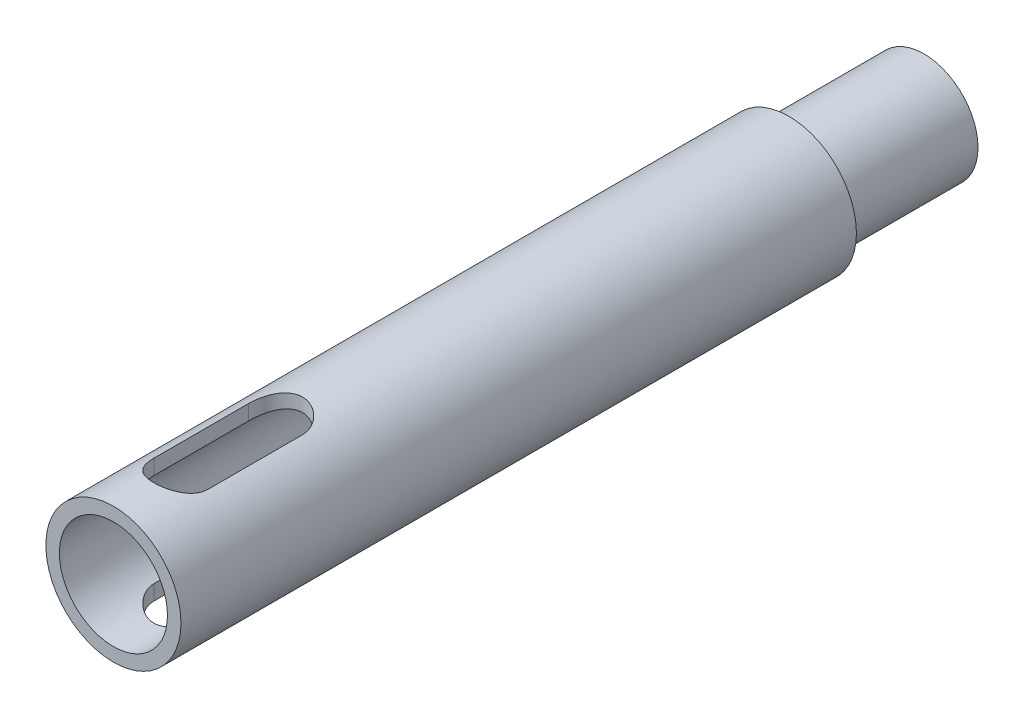
from build123d import *

# Parameters (mm, degrees)
SKETCH1_R               = 5
BOSS_EXTRUDE1_DEPTH     = 60
SKETCH1_4_R             = 5
SKETCH1_4_R_2           = 4
CUT_EXTRUDE1_DEPTH      = 10
CUT_EXTRUDE2_START      = 40
SKETCH1_5_R             = 4
CUT_EXTRUDE2_DEPTH      = 20
CUT_EXTRUDE3_DEPTH      = 61.415229868
CUT_EXTRUDE3_DEPTH_BACK = 61.415229868


with BuildPart() as part:
    # Sketch1 → Boss-Extrude1 (new body)
    with BuildSketch(Plane.XY):
        Circle(SKETCH1_R)
    extrude(amount=BOSS_EXTRUDE1_DEPTH)

    # Sketch1<4> → Cut-Extrude1 (cut)
    with BuildSketch(Plane.XY):
        Circle(SKETCH1_4_R)
        Circle(SKETCH1_4_R_2, mode=Mode.SUBTRACT)
    extrude(amount=CUT_EXTRUDE1_DEPTH, mode=Mode.SUBTRACT)

    # Sketch1<5> → Cut-Extrude2 (cut)
    with BuildSketch(Plane.XY.offset(CUT_EXTRUDE2_START)):
        Circle(SKETCH1_5_R)
    extrude(amount=CUT_EXTRUDE2_DEPTH, mode=Mode.SUBTRACT)

    # Sketch2 → Cut-Extrude3 (cut, two sides: drawn at the far end of the back side and taken through both)
    with BuildSketch(Plane(origin=(0, 0, 0), x_dir=(1, 0, 0), z_dir=(0, 1, 0)).offset(-CUT_EXTRUDE3_DEPTH_BACK)):
        with BuildLine():
            Line((2, -48), (2, -55))
            ThreePointArc((2, -55), (0, -57), (-2, -55))
            Line((-2, -55), (-2, -48))
            ThreePointArc((-2, -48), (0, -46), (2, -48))
        make_face()
    extrude(amount=CUT_EXTRUDE3_DEPTH + CUT_EXTRUDE3_DEPTH_BACK, mode=Mode.SUBTRACT)


solid = part.part
